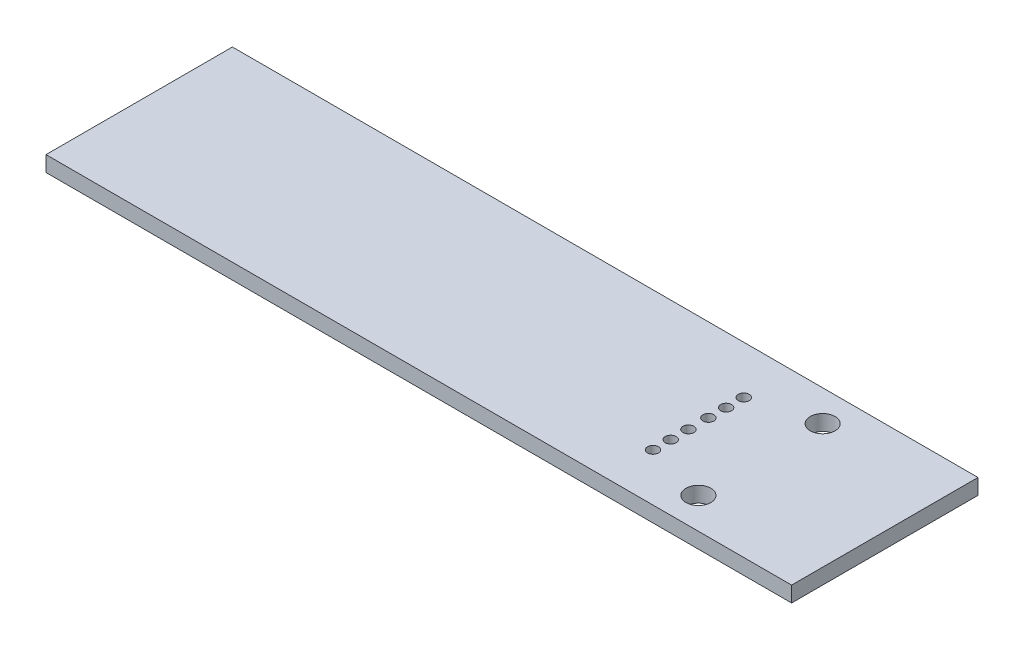
from build123d import *

# Parameters (mm, degrees)
SKETCH1_W           = 76.2
SKETCH1_H           = 19.05
SKETCH1_R           = 1.27
SKETCH1_R_2         = 0.558095423
BOSS_EXTRUDE1_DEPTH = 1.5875


with BuildPart() as part:
    # Sketch1 → Boss-Extrude1 (new body)
    with BuildSketch(Plane(origin=(0, 0, 0), x_dir=(1, 0, 0), z_dir=(0, 1, 0))):
        Rectangle(SKETCH1_W, SKETCH1_H)
        with Locations(Location((25.4, 6.35, 0), (0, 0, 270))):
            Circle(SKETCH1_R, mode=Mode.SUBTRACT)
        with Locations(Location((25.4, -6.35, 0), (0, 0, 270))):
            Circle(SKETCH1_R, mode=Mode.SUBTRACT)
        with Locations(Location((19.05, -4.636868291, 0), (0, 0, 270))):
            Circle(SKETCH1_R_2, mode=Mode.SUBTRACT)
        with Locations(Location((19.05, -2.829232885, 0), (0, 0, 270))):
            Circle(SKETCH1_R_2, mode=Mode.SUBTRACT)
        with Locations(Location((19.05, -1.021597478, 0), (0, 0, 270))):
            Circle(SKETCH1_R_2, mode=Mode.SUBTRACT)
        with Locations(Location((19.05, 4.636868291, 0), (0, 0, 270))):
            Circle(SKETCH1_R_2, mode=Mode.SUBTRACT)
        with Locations(Location((19.05, 2.829232885, 0), (0, 0, 270))):
            Circle(SKETCH1_R_2, mode=Mode.SUBTRACT)
        with Locations(Location((19.05, 1.021597478, 0), (0, 0, 270))):
            Circle(SKETCH1_R_2, mode=Mode.SUBTRACT)
    extrude(amount=BOSS_EXTRUDE1_DEPTH)


solid = part.part
